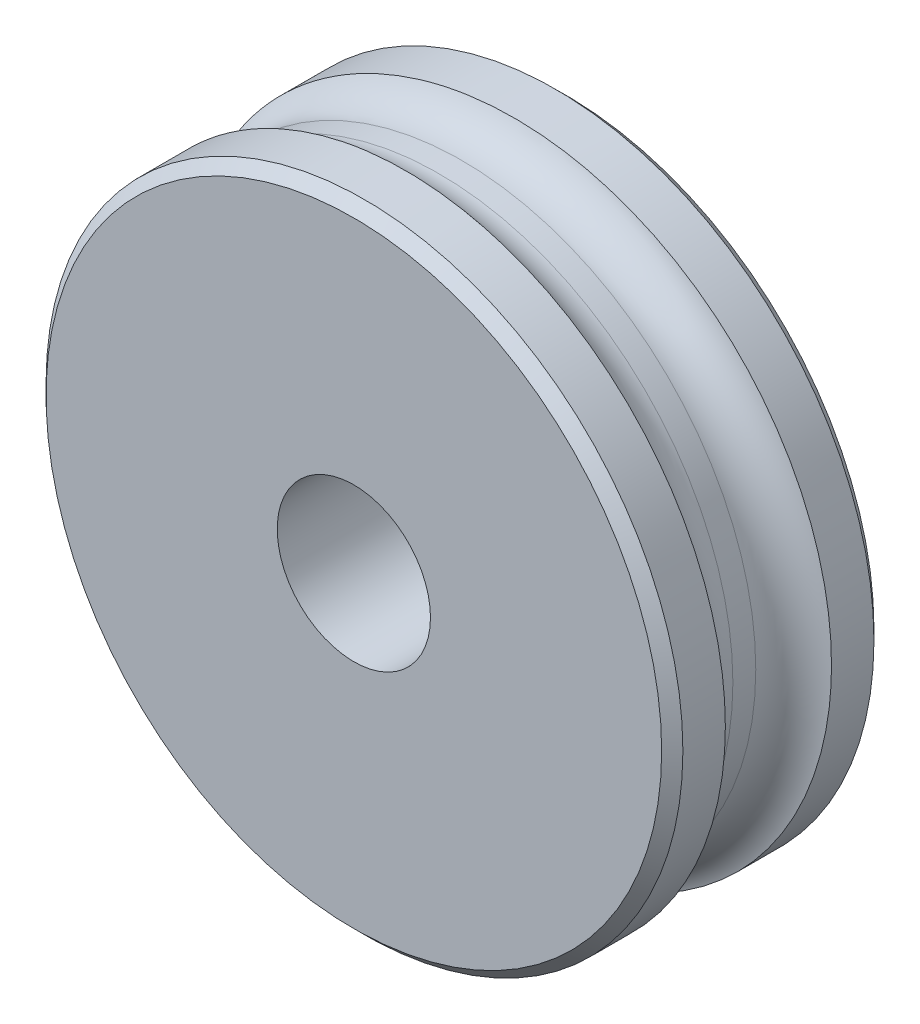
from build123d import *

# Parameters (mm, degrees)
SKETCH_1_R      = 60
SKETCH_1_R_2    = 14.438127561
EXTRUDE_1_DEPTH = 40
CHAMFER_1_SIZE  = 2


with BuildPart() as part:
    # 草图1 → 凸台-拉伸1 (new body)
    with BuildSketch(Plane.XY.offset(70.26)):
        with Locations((-297.670899951, 626.415366791)):
            Circle(SKETCH_1_R)
        with Locations((-297.670899951, 626.415366791)):
            Circle(SKETCH_1_R_2, mode=Mode.SUBTRACT)
    extrude(amount=-EXTRUDE_1_DEPTH)

    # 草图4 → 切除-旋转1 (revolve, cut)
    with BuildSketch(Plane(origin=(0, 626.415366791, 0), x_dir=(1, 0, 0), z_dir=(0, 1, 0))):
        with BuildLine():
            Line((-244.095308656, -48.103310059), (-244.095308655, -52.416689982))
            ThreePointArc((-244.095308655, -52.416689982), (-242.284199059, -57.48597347), (-237.670899813, -60.259999987))
            Line((-237.670899813, -60.259999987), (-237.670899811, -40.260000013))
            ThreePointArc((-237.670899811, -40.260000013), (-242.284199071, -43.034026546), (-244.095308656, -48.103310059))
        make_face()
    revolve(axis=Axis((-299.491656028, 626.415366791, 70.26), (0, 0, -1)), mode=Mode.SUBTRACT)

    # 倒角1
    chamfer_1_edges = [part.edges().sort_by_distance(p)[0] for p in [
        (-357.670899951, 626.415366791, 70.26),
        (-357.670899951, 626.415366791, 30.26),
    ]]
    chamfer(chamfer_1_edges, length=CHAMFER_1_SIZE)


solid = part.part
